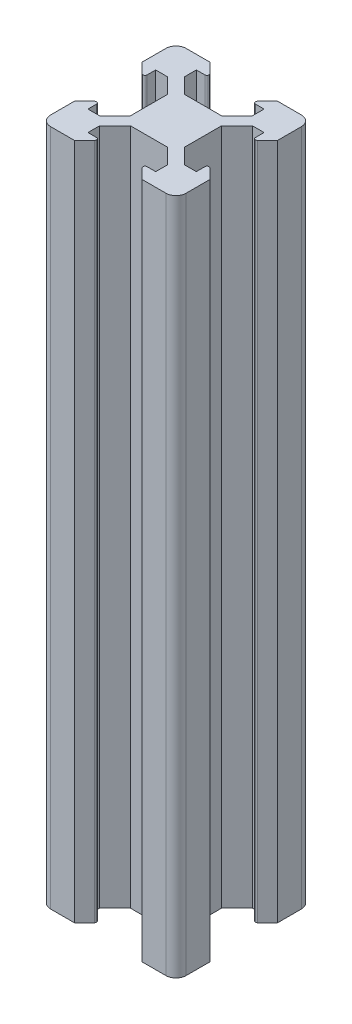
from build123d import *

# Parameters (mm, degrees)
EXTRUDE_1_DEPTH = 100


with BuildPart() as part:
    # Эскиз1 → Бобышка-Вытянуть1 (new body)
    with BuildSketch(Plane(origin=(0, 0, 0), x_dir=(1, 0, 0), z_dir=(0, 1, 0))):
        with BuildLine():
            Line((6.272792206, 5), (8, 5))
            Line((8, 5), (8, 3.724264069))
            ThreePointArc((8, 3.724264069), (8.18519497, 3.447100209), (8.512132034, 3.512132034))
            Line((8.512132034, 3.512132034), (10, 5))
            Line((10, 5), (10, 8.5))
            ThreePointArc((10, 8.5), (9.560660172, 9.560660172), (8.5, 10))
            Line((8.5, 10), (5, 10))
            Line((5, 10), (3.512132034, 8.512132034))
            ThreePointArc((3.512132034, 8.512132034), (3.447100209, 8.18519497), (3.724264069, 8))
            Line((3.724264069, 8), (5, 8))
            Line((5, 8), (5, 6.272792206))
            Line((5, 6.272792206), (2.727207794, 4))
            Line((2.727207794, 4), (-2.727207794, 4))
            Line((-2.727207794, 4), (-5, 6.272792206))
            Line((-5, 6.272792206), (-5, 8))
            Line((-5, 8), (-3.724264069, 8))
            ThreePointArc((-3.724264069, 8), (-3.447100209, 8.18519497), (-3.512132034, 8.512132034))
            Line((-3.512132034, 8.512132034), (-5, 10))
            Line((-5, 10), (-8.5, 10))
            ThreePointArc((-8.5, 10), (-9.560660172, 9.560660172), (-10, 8.5))
            Line((-10, 8.5), (-10, 5))
            Line((-10, 5), (-8.512132034, 3.512132034))
            ThreePointArc((-8.512132034, 3.512132034), (-8.18519497, 3.447100209), (-8, 3.724264069))
            Line((-8, 3.724264069), (-8, 5))
            Line((-8, 5), (-6.272792206, 5))
            Line((-6.272792206, 5), (-4, 2.727207794))
            Line((-4, 2.727207794), (-4, -2.727207794))
            Line((-4, -2.727207794), (-6.272792206, -5))
            Line((-6.272792206, -5), (-8, -5))
            Line((-8, -5), (-8, -3.724264069))
            ThreePointArc((-8, -3.724264069), (-8.18519497, -3.447100209), (-8.512132034, -3.512132034))
            Line((-8.512132034, -3.512132034), (-10, -5))
            Line((-10, -5), (-10, -8.5))
            ThreePointArc((-10, -8.5), (-9.560660172, -9.560660172), (-8.5, -10))
            Line((-8.5, -10), (-5, -10))
            Line((-5, -10), (-3.512132034, -8.512132034))
            ThreePointArc((-3.512132034, -8.512132034), (-3.447100209, -8.18519497), (-3.724264069, -8))
            Line((-3.724264069, -8), (-5, -8))
            Line((-5, -8), (-5, -6.272792206))
            Line((-5, -6.272792206), (-2.727207794, -4))
            Line((-2.727207794, -4), (2.727207794, -4))
            Line((2.727207794, -4), (5, -6.272792206))
            Line((5, -6.272792206), (5, -8))
            Line((5, -8), (3.724264069, -8))
            ThreePointArc((3.724264069, -8), (3.447100209, -8.18519497), (3.512132034, -8.512132034))
            Line((3.512132034, -8.512132034), (5, -10))
            Line((5, -10), (8.5, -10))
            ThreePointArc((8.5, -10), (9.560660172, -9.560660172), (10, -8.5))
            Line((10, -8.5), (10, -5))
            Line((10, -5), (8.512132034, -3.512132034))
            ThreePointArc((8.512132034, -3.512132034), (8.18519497, -3.447100209), (8, -3.724264069))
            Line((8, -3.724264069), (8, -5))
            Line((8, -5), (6.272792206, -5))
            Line((6.272792206, -5), (4, -2.727207794))
            Line((4, -2.727207794), (4, 2.727207794))
            Line((4, 2.727207794), (6.272792206, 5))
        make_face()
    extrude(amount=EXTRUDE_1_DEPTH)


solid = part.part
